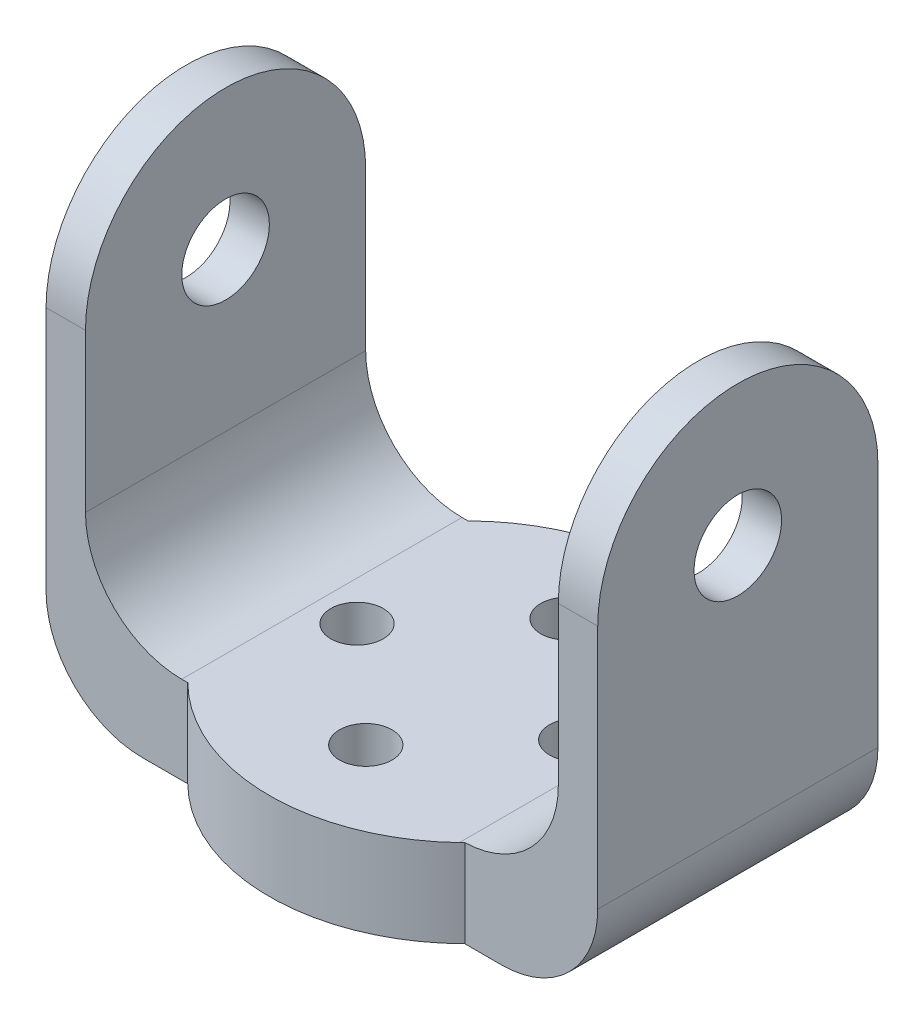
from build123d import *

# Parameters (mm, degrees)
BOSS_EXTRUDE1_DEPTH     = 32
SKETCH2_R               = 22.5
BOSS_EXTRUDE4_DEPTH     = 10
CUT_EXTRUDE1_DEPTH      = 80.029560932
CUT_EXTRUDE1_DEPTH_BACK = 80.029560932
SKETCH3_R               = 5
FILLET3_R               = 11
FILLET4_RADIUS          = 16
FILLET4_LENGTH          = 4.5
FILLET5_RADIUS          = 16
FILLET5_LENGTH          = 4.5
CUT_EXTRUDE2_DEPTH      = 74.711106836
CUT_EXTRUDE2_DEPTH_BACK = 74.711106836
SKETCH4_R               = 3


with BuildPart() as part:
    # Sketch1 → Boss-Extrude1 (new body)
    with BuildSketch(Plane.XY):
        Polygon((-19.112903226, 28.185483871), (-19.112903226, -26.814516129), (43.887096774, -26.814516129), (43.887096774, 28.185483871), (39.387096774, 28.185483871), (39.387096774, -16.814516129), (-14.612903226, -16.814516129), (-14.612903226, 28.185483871), align=None)
    extrude(amount=BOSS_EXTRUDE1_DEPTH)

    # Sketch2 → Boss-Extrude4 (add)
    with BuildSketch(Plane.XZ.offset(26.814516129)):
        with Locations((12.887096774, 16)):
            Circle(SKETCH2_R)
    extrude(amount=-BOSS_EXTRUDE4_DEPTH)

    # Sketch3 → Cut-Extrude1 (cut, two sides: drawn at the far end of the back side and taken through both)
    with BuildSketch(Plane(origin=(43.887096774, 0, 0), x_dir=(0, 0, -1), z_dir=(1, 0, 0)).offset(-CUT_EXTRUDE1_DEPTH_BACK)):
        with Locations(Location((-16, 12.185483871, 0), (0, 0, 90))):
            Circle(SKETCH3_R)
    extrude(amount=CUT_EXTRUDE1_DEPTH + CUT_EXTRUDE1_DEPTH_BACK, mode=Mode.SUBTRACT)

    # Fillet3
    fillet3_edges = [part.edges().sort_by_distance(p)[0] for p in [
        (-14.612903226, -16.814516129, 16),
        (39.387096774, -16.814516129, 16),
        (43.887096774, -26.814516129, 16),
        (-19.112903226, -26.814516129, 16),
    ]]
    fillet(fillet3_edges, radius=FILLET3_R)

    # Fillet4: full round fillet: the end face becomes a half cylinder, R = half its width
    fillet4_face = Plane((41.637096774, 28.185483871, 16), x_dir=(1, 0, 0), z_dir=(0, 1, 0))  # on the end face: x along it, z out of the body
    fillet4_slab = fillet4_face.offset(-FILLET4_RADIUS / 2) * Box(FILLET4_LENGTH, 2 * FILLET4_RADIUS, FILLET4_RADIUS, mode=Mode.PRIVATE)  # the body's end, R deep
    fillet4_round = Plane((41.637096774, 12.185483871, 16), x_dir=(0, 1, 0), z_dir=(1, 0, 0)) * Cylinder(FILLET4_RADIUS, FILLET4_LENGTH, mode=Mode.PRIVATE)  # its axis R under the face
    add(fillet4_slab - fillet4_round, mode=Mode.SUBTRACT)

    # Fillet5: full round fillet: the end face becomes a half cylinder, R = half its width
    fillet5_face = Plane((-16.862903226, 28.185483871, 16), x_dir=(-1, 0, 0), z_dir=(0, 1, 0))  # on the end face: x along it, z out of the body
    fillet5_slab = fillet5_face.offset(-FILLET5_RADIUS / 2) * Box(FILLET5_LENGTH, 2 * FILLET5_RADIUS, FILLET5_RADIUS, mode=Mode.PRIVATE)  # the body's end, R deep
    fillet5_round = Plane((-16.862903226, 12.185483871, 16), x_dir=(0, 1, 0), z_dir=(-1, 0, 0)) * Cylinder(FILLET5_RADIUS, FILLET5_LENGTH, mode=Mode.PRIVATE)  # its axis R under the face
    add(fillet5_slab - fillet5_round, mode=Mode.SUBTRACT)

    # Sketch4 → Cut-Extrude2 (cut, two sides: drawn at the far end of the back side and taken through both)
    with BuildSketch(Plane(origin=(0, -16.814516129, 0), x_dir=(1, 0, 0), z_dir=(0, 1, 0)).offset(-CUT_EXTRUDE2_DEPTH_BACK)):
        with Locations(Location((12.387096774, -4.010421192, 0), (0, 0, 180))):
            Circle(SKETCH4_R)
        with Locations(Location((24.876675582, -15.5, 0), (0, 0, 180))):
            Circle(SKETCH4_R)
        with Locations(Location((13.387096774, -27.989578808, 0), (0, 0, 180))):
            Circle(SKETCH4_R)
        with Locations(Location((0.897517966, -16.5, 0), (0, 0, 180))):
            Circle(SKETCH4_R)
    extrude(amount=CUT_EXTRUDE2_DEPTH + CUT_EXTRUDE2_DEPTH_BACK, mode=Mode.SUBTRACT)


solid = part.part
